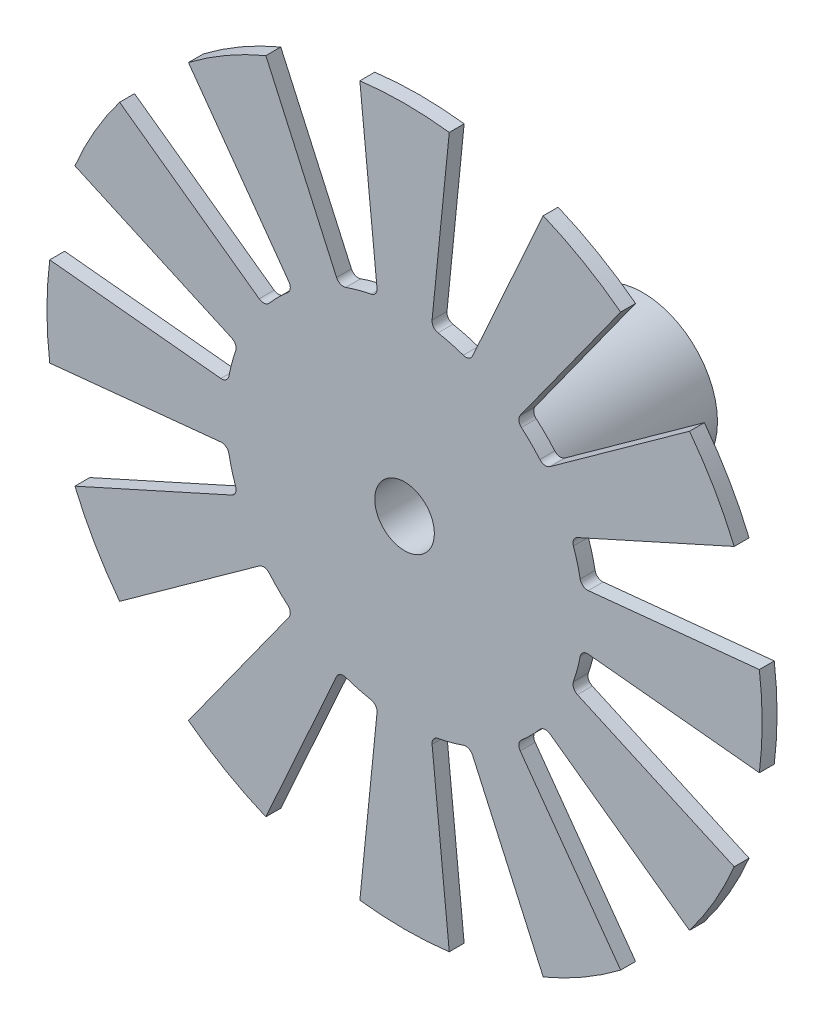
from build123d import *
from build123d.topology import SkipClean

# Parameters (mm, degrees)
CROQUIS1_R              = 1
SALIENTE_EXTRUIR2_DEPTH = 0.5
REDONDEO1_R             = 0.25
SALIENTE_EXTRUIR3_START = 7.5
CROQUIS2_R              = 2.5
CROQUIS2_R_2            = 1
SALIENTE_EXTRUIR3_DEPTH = 7.5


with BuildPart() as part:
    # Croquis1 → Saliente-Extruir2 (new body)
    with BuildSketch(Plane.XY):
        with BuildLine():
            Line((-0.9, 5.93211598), (-1.5, 11.9058809))
            ThreePointArc((-1.5, 11.9058809), (0, 12), (1.5, 11.9058809))
            Line((1.5, 11.9058809), (0.9, 5.93211598))
            ThreePointArc((0.9, 5.93211598), (1.552914271, 5.795554958), (2.186635127, 5.587363137))
            Line((2.186635127, 5.587363137), (4.653902344, 11.060795314))
            ThreePointArc((4.653902344, 11.060795314), (6, 10.392304845), (7.251978556, 9.560795314))
            Line((7.251978556, 9.560795314), (3.745480853, 4.687363137))
            ThreePointArc((3.745480853, 4.687363137), (4.242640687, 4.242640687), (4.687363137, 3.745480853))
            Line((4.687363137, 3.745480853), (9.560795314, 7.251978556))
            ThreePointArc((9.560795314, 7.251978556), (10.392304845, 6), (11.060795314, 4.653902344))
            Line((11.060795314, 4.653902344), (5.587363137, 2.186635127))
            ThreePointArc((5.587363137, 2.186635127), (5.795554958, 1.552914271), (5.93211598, 0.9))
            Line((5.93211598, 0.9), (11.9058809, 1.5))
            ThreePointArc((11.9058809, 1.5), (12, 0), (11.9058809, -1.5))
            Line((11.9058809, -1.5), (5.93211598, -0.9))
            ThreePointArc((5.93211598, -0.9), (5.795554958, -1.552914271), (5.587363137, -2.186635127))
            Line((5.587363137, -2.186635127), (11.060795314, -4.653902344))
            ThreePointArc((11.060795314, -4.653902344), (10.392304845, -6), (9.560795314, -7.251978556))
            Line((9.560795314, -7.251978556), (4.687363137, -3.745480853))
            ThreePointArc((4.687363137, -3.745480853), (4.242640687, -4.242640687), (3.745480853, -4.687363137))
            Line((3.745480853, -4.687363137), (7.251978556, -9.560795314))
            ThreePointArc((7.251978556, -9.560795314), (6, -10.392304845), (4.653902344, -11.060795314))
            Line((4.653902344, -11.060795314), (2.186635127, -5.587363137))
            ThreePointArc((2.186635127, -5.587363137), (1.552914271, -5.795554958), (0.9, -5.93211598))
            Line((0.9, -5.93211598), (1.5, -11.9058809))
            ThreePointArc((1.5, -11.9058809), (0, -12), (-1.5, -11.9058809))
            Line((-1.5, -11.9058809), (-0.9, -5.93211598))
            ThreePointArc((-0.9, -5.93211598), (-1.552914271, -5.795554958), (-2.186635127, -5.587363137))
            Line((-2.186635127, -5.587363137), (-4.653902344, -11.060795314))
            ThreePointArc((-4.653902344, -11.060795314), (-6, -10.392304845), (-7.251978556, -9.560795314))
            Line((-7.251978556, -9.560795314), (-3.745480853, -4.687363137))
            ThreePointArc((-3.745480853, -4.687363137), (-4.242640687, -4.242640687), (-4.687363137, -3.745480853))
            Line((-4.687363137, -3.745480853), (-9.560795314, -7.251978556))
            ThreePointArc((-9.560795314, -7.251978556), (-10.392304845, -6), (-11.060795314, -4.653902344))
            Line((-11.060795314, -4.653902344), (-5.587363137, -2.186635127))
            ThreePointArc((-5.587363137, -2.186635127), (-5.795554958, -1.552914271), (-5.93211598, -0.9))
            Line((-5.93211598, -0.9), (-11.9058809, -1.5))
            ThreePointArc((-11.9058809, -1.5), (-12, 0), (-11.9058809, 1.5))
            Line((-11.9058809, 1.5), (-5.93211598, 0.9))
            ThreePointArc((-5.93211598, 0.9), (-5.795554958, 1.552914271), (-5.587363137, 2.186635127))
            Line((-5.587363137, 2.186635127), (-11.060795314, 4.653902344))
            ThreePointArc((-11.060795314, 4.653902344), (-10.392304845, 6), (-9.560795314, 7.251978556))
            Line((-9.560795314, 7.251978556), (-4.687363137, 3.745480853))
            ThreePointArc((-4.687363137, 3.745480853), (-4.242640687, 4.242640687), (-3.745480853, 4.687363137))
            Line((-3.745480853, 4.687363137), (-7.251978556, 9.560795314))
            ThreePointArc((-7.251978556, 9.560795314), (-6, 10.392304845), (-4.653902344, 11.060795314))
            Line((-4.653902344, 11.060795314), (-2.186635127, 5.587363137))
            ThreePointArc((-2.186635127, 5.587363137), (-1.552914271, 5.795554958), (-0.9, 5.93211598))
        make_face()
        Circle(CROQUIS1_R, mode=Mode.SUBTRACT)
    extrude(amount=SALIENTE_EXTRUIR2_DEPTH)

    # Redondeo1
    redondeo1_edges = [part.edges().sort_by_distance(p)[0] for p in [
        (-0.9, 5.93211598, 0.25),
        (0.9, 5.93211598, 0.25),
        (2.186635127, 5.587363137, 0.25),
        (3.745480853, 4.687363137, 0.25),
        (4.687363137, 3.745480853, 0.25),
        (5.587363137, 2.186635127, 0.25),
        (5.93211598, 0.9, 0.25),
        (5.93211598, -0.9, 0.25),
        (5.587363137, -2.186635127, 0.25),
        (4.687363137, -3.745480853, 0.25),
        (3.745480853, -4.687363137, 0.25),
        (2.186635127, -5.587363137, 0.25),
        (0.9, -5.93211598, 0.25),
        (-0.9, -5.93211598, 0.25),
        (-2.186635127, -5.587363137, 0.25),
        (-3.745480853, -4.687363137, 0.25),
        (-4.687363137, -3.745480853, 0.25),
        (-5.587363137, -2.186635127, 0.25),
        (-5.93211598, -0.9, 0.25),
        (-5.93211598, 0.9, 0.25),
        (-5.587363137, 2.186635127, 0.25),
        (-4.687363137, 3.745480853, 0.25),
        (-3.745480853, 4.687363137, 0.25),
        (-2.186635127, 5.587363137, 0.25),
    ]]
    fillet(redondeo1_edges, radius=REDONDEO1_R)

    # Croquis2 → Saliente-Extruir3 (add)
    with SkipClean():  # the faces are left unmerged after this step: merging them gives an invalid solid
        with BuildSketch(Plane(origin=(0, 0, 0), x_dir=(-1, 0, 0), z_dir=(0, 0, -1)).offset(SALIENTE_EXTRUIR3_START)):
            with Locations(Location((0, 0, 0), (0, 0, 180))):
                Circle(CROQUIS2_R)
            Circle(CROQUIS2_R_2, mode=Mode.SUBTRACT)
        extrude(amount=-SALIENTE_EXTRUIR3_DEPTH)


solid = part.part
